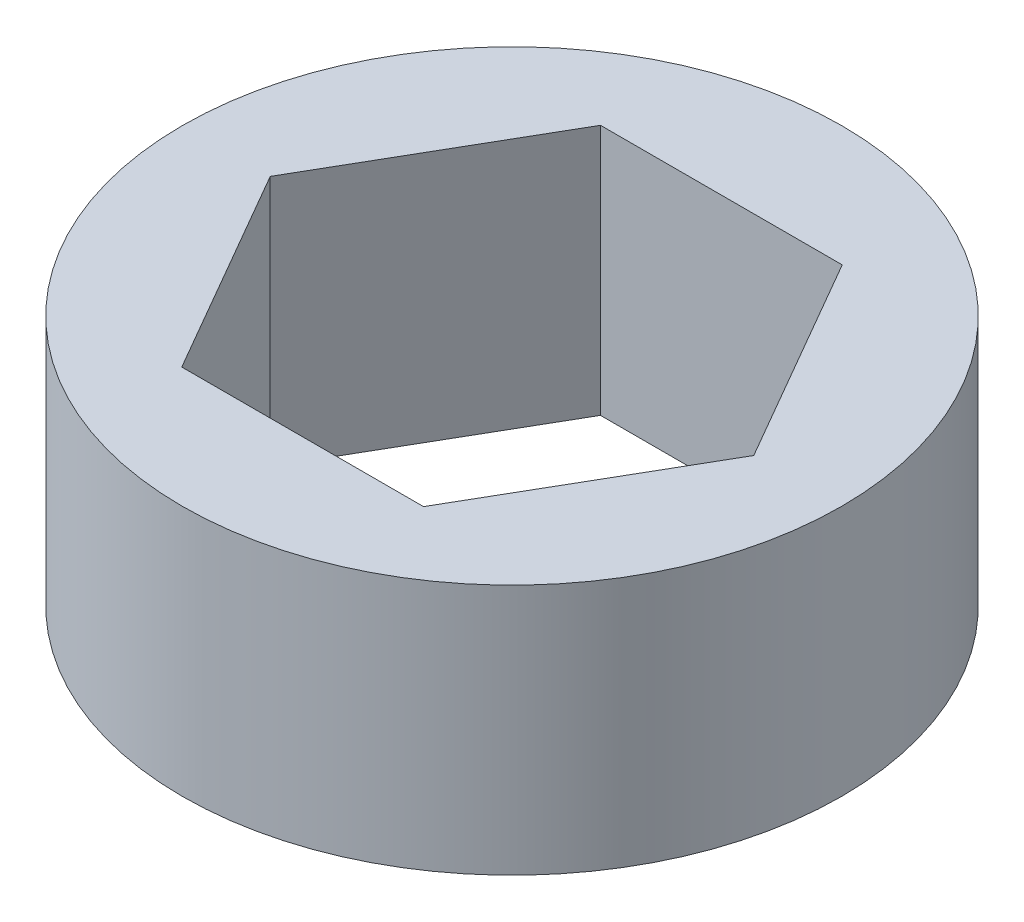
from build123d import *

# Parameters (mm, degrees)
SKETCH1_R           = 10
BOSS_EXTRUDE1_DEPTH = 7.62


with BuildPart() as part:
    # Sketch1 → Boss-Extrude1 (new body)
    with BuildSketch(Plane(origin=(0, 0, 0), x_dir=(1, 0, 0), z_dir=(0, 1, 0))):
        with Locations(Location((0, 0, 0), (0, 0, 90))):
            Circle(SKETCH1_R)
        Polygon((-7.332348419, 0), (-3.666174209, -6.35), (3.666174209, -6.35), (7.332348419, 0), (3.666174209, 6.35), (-3.666174209, 6.35), align=None, mode=Mode.SUBTRACT)
    extrude(amount=BOSS_EXTRUDE1_DEPTH)


solid = part.part
